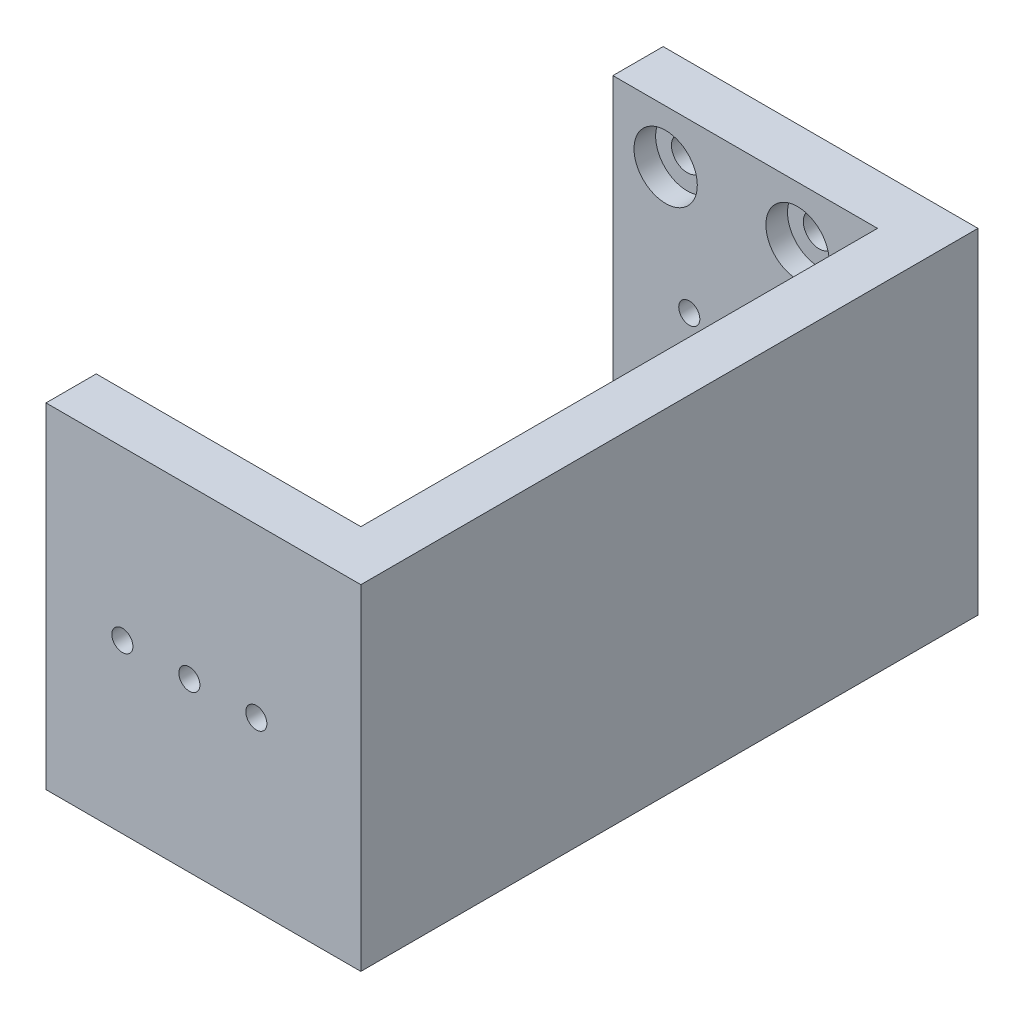
from build123d import *

# Parameters (mm, degrees)
SKETCH1_W           = 59.69
SKETCH1_H           = 63.5
SKETCH1_R           = 2
BOSS_EXTRUDE1_DEPTH = 117
SKETCH2_W           = 50.165
SKETCH2_H           = 97.95
CUT_EXTRUDE1_DEPTH  = 138.033864953
SKETCH3_R           = 6
SKETCH3_R_2         = 3
CUT_EXTRUDE2_DEPTH  = 4.1
SKETCH5_R           = 3
CUT_EXTRUDE3_DEPTH  = 117.687481201


with BuildPart() as part:
    # Sketch1 → Boss-Extrude1 (new body)
    with BuildSketch(Plane.XY):
        with Locations((2.667, 0)):
            Rectangle(SKETCH1_W, SKETCH1_H)
        with Locations((-12.7, 0)):
            Circle(SKETCH1_R, mode=Mode.SUBTRACT)
        Circle(SKETCH1_R, mode=Mode.SUBTRACT)
        with Locations((12.7, 0)):
            Circle(SKETCH1_R, mode=Mode.SUBTRACT)
    extrude(amount=BOSS_EXTRUDE1_DEPTH)

    # Sketch2 → Cut-Extrude1 (cut, through all)
    with BuildSketch(Plane.XZ.offset(31.75)):
        with Locations((-2.0955, 58.5)):
            Rectangle(SKETCH2_W, SKETCH2_H)
    extrude(amount=-CUT_EXTRUDE1_DEPTH, mode=Mode.SUBTRACT)

    # Sketch3 → Cut-Extrude2 (cut)
    # profile 1 of 4: a face of its own
    with BuildSketch(Plane.XY.offset(9.525)):
        with Locations((-17.178, -21.75)):
            Circle(SKETCH3_R)
        with Locations((-17.178, -21.75)):
            Circle(SKETCH3_R_2, mode=Mode.SUBTRACT)
    # profile 2 of 4: a face of its own
    with BuildSketch(Plane.XY.offset(9.525)):
        with Locations((7.822, -21.75)):
            Circle(SKETCH3_R)
        with Locations((7.822, -21.75)):
            Circle(SKETCH3_R_2, mode=Mode.SUBTRACT)
    # profile 3 of 4: a face of its own
    with BuildSketch(Plane.XY.offset(9.525)):
        with Locations((-17.178, 21.75)):
            Circle(SKETCH3_R)
        with Locations((-17.178, 21.75)):
            Circle(SKETCH3_R_2, mode=Mode.SUBTRACT)
    # profile 4 of 4: a face of its own
    with BuildSketch(Plane.XY.offset(9.525)):
        with Locations((7.822, 21.75)):
            Circle(SKETCH3_R)
        with Locations((7.822, 21.75)):
            Circle(SKETCH3_R_2, mode=Mode.SUBTRACT)
    extrude(amount=-CUT_EXTRUDE2_DEPTH, mode=Mode.SUBTRACT)

    # Sketch5 → Cut-Extrude3 (cut, through all)
    with BuildSketch(Plane.XY.offset(9.525)):
        with Locations((-17.178, 21.75)):
            Circle(SKETCH5_R)
        with Locations((7.822, 21.75)):
            Circle(SKETCH5_R)
        with Locations((7.822, -21.75)):
            Circle(SKETCH5_R)
        with Locations((-17.178, -21.75)):
            Circle(SKETCH5_R)
    extrude(amount=-CUT_EXTRUDE3_DEPTH, mode=Mode.SUBTRACT)


solid = part.part
